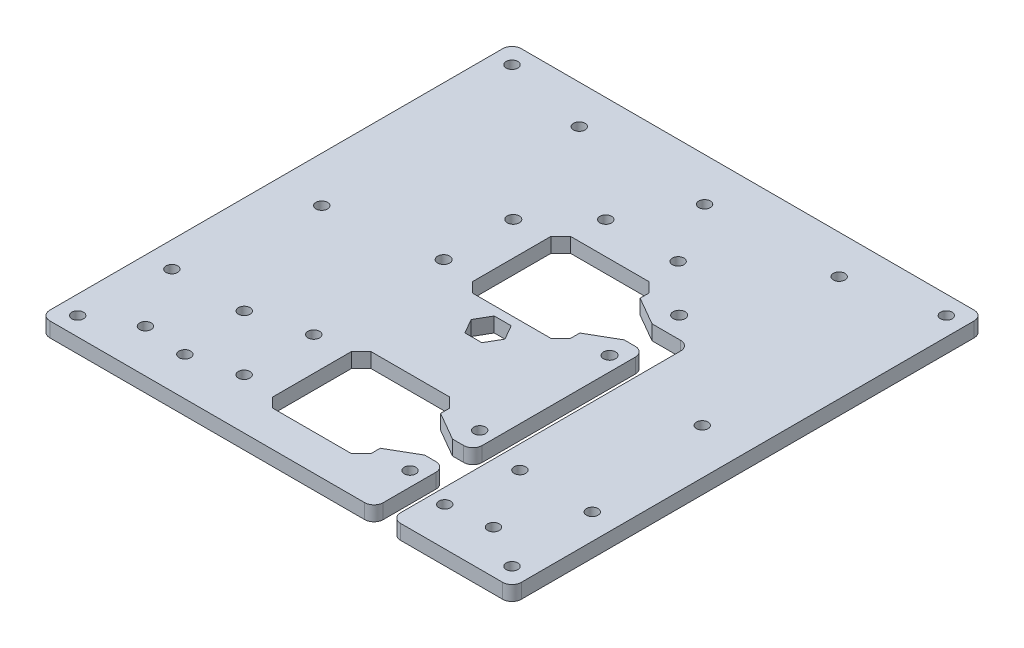
from build123d import *
from OCP.BRepFilletAPI import BRepFilletAPI_MakeChamfer

# Parameters (mm, degrees)
ESQUISSE1_W              = 203.2
ESQUISSE1_H              = 203.2
BOSS_EXTRU_1_DEPTH       = 6.35
ESQUISSE2_R              = 2.5
ENL_V_MAT_EXTRU_1_DEPTH  = 144.824345992
ESQUISSE3_R              = 2.5
ENL_V_MAT_EXTRU_2_DEPTH  = 144.824345992
ESQUISSE4_R              = 2.5
ENL_V_MAT_EXTRU_3_DEPTH  = 144.824345992
ESQUISSE6_R              = 2.5
ENL_V_MAT_EXTRU_5_DEPTH  = 144.824345992
ENL_V_MAT_EXTRU_9_DEPTH  = 144.824345992
ENL_V_MAT_EXTRU_4_DEPTH  = 144.824345992
ENL_V_MAT_EXTRU_7_DEPTH  = 144.824345992
ENL_V_MAT_EXTRU_8_DEPTH  = 144.824345992
CONG_2_R                 = 4
ESQUISSE12_R             = 2.6
ENL_V_MAT_EXTRU_10_DEPTH = 144.824345992
CHANFREIN2_SIZE          = 7
CHANFREIN2_SIZE2         = 12.124355653
CHANFREIN3_SIZE          = 7
CHANFREIN3_SIZE2         = 12.124355653


with BuildPart() as part:
    # Esquisse1 → Boss.-Extru.1 (new body)
    with BuildSketch(Plane(origin=(0, 0, 0), x_dir=(1, 0, 0), z_dir=(0, 1, 0))):
        Rectangle(ESQUISSE1_W, ESQUISSE1_H)
    extrude(amount=BOSS_EXTRU_1_DEPTH)

    # Esquisse2 → Enlèv. mat.-Extru.1 (cut, through all)
    with BuildSketch(Plane(origin=(0, 6.35, 0), x_dir=(1, 0, 0), z_dir=(0, 1, 0))):
        with Locations(Location((-35.6, -49.85, 0), (0, 0, 270))):
            Circle(ESQUISSE2_R)
        with Locations(Location((-35.6, -79.85, 0), (0, 0, 270))):
            Circle(ESQUISSE2_R)
        with Locations(Location((35.9, -79.85, 0), (0, 0, 270))):
            Circle(ESQUISSE2_R)
        with Locations(Location((35.9, -49.85, 0), (0, 0, 270))):
            Circle(ESQUISSE2_R)
    extrude(amount=-ENL_V_MAT_EXTRU_1_DEPTH, mode=Mode.SUBTRACT)

    # Esquisse3 → Enlèv. mat.-Extru.2 (cut, through all)
    with BuildSketch(Plane(origin=(0, 6.35, 0), x_dir=(1, 0, 0), z_dir=(0, 1, 0))):
        with Locations(Location((-93.6, 93.6, 0), (0, 0, 270))):
            Circle(ESQUISSE3_R)
        with Locations(Location((93.6, 93.6, 0), (0, 0, 270))):
            Circle(ESQUISSE3_R)
        with Locations(Location((93.6, -93.6, 0), (0, 0, 270))):
            Circle(ESQUISSE3_R)
        with Locations(Location((-93.6, -93.6, 0), (0, 0, 270))):
            Circle(ESQUISSE3_R)
    extrude(amount=-ENL_V_MAT_EXTRU_2_DEPTH, mode=Mode.SUBTRACT)

    # Esquisse4 → Enlèv. mat.-Extru.3 (cut, through all)
    with BuildSketch(Plane(origin=(0, 6.35, 0), x_dir=(1, 0, 0), z_dir=(0, 1, 0))):
        with Locations(Location((15.588457268, 56, 0), (0, 0, 270))):
            Circle(ESQUISSE4_R)
        with Locations(Location((-15.588457268, 56, 0), (0, 0, 270))):
            Circle(ESQUISSE4_R)
        with Locations(Location((0, 83, 0), (0, 0, 270))):
            Circle(ESQUISSE4_R)
        with Locations(Location((-75, -83, 0), (0, 0, 270))):
            Circle(ESQUISSE4_R)
        with Locations(Location((-90.588457268, -56, 0), (0, 0, 270))):
            Circle(ESQUISSE4_R)
        with Locations(Location((-59.411542732, -56, 0), (0, 0, 270))):
            Circle(ESQUISSE4_R)
        with Locations(Location((59.413008586, -55.999154304, 0), (0, 0, 270))):
            Circle(ESQUISSE4_R)
        with Locations(Location((90.589923123, -55.999154304, 0), (0, 0, 270))):
            Circle(ESQUISSE4_R)
        with Locations(Location((75.001465855, -82.999154304, 0), (0, 0, 270))):
            Circle(ESQUISSE4_R)
    extrude(amount=-ENL_V_MAT_EXTRU_3_DEPTH, mode=Mode.SUBTRACT)

    # Esquisse6 → Enlèv. mat.-Extru.5 (cut, through all)
    with BuildSketch(Plane.XZ):
        with Locations(Location((-56, 85, 0), (0, 0, 270))):
            Circle(ESQUISSE6_R)
        with Locations(Location((-56, -85, 0), (0, 0, 270))):
            Circle(ESQUISSE6_R)
        with Locations(Location((-82, 0, 0), (0, 0, 270))):
            Circle(ESQUISSE6_R)
    enl_v_mat_extru_5 = extrude(amount=-ENL_V_MAT_EXTRU_5_DEPTH, mode=Mode.SUBTRACT)

    # Symétrie1: Enlèv. mat.-Extru.5 across plane
    add(enl_v_mat_extru_5.mirror(Plane(origin=(0, 0, 0), x_dir=(0, 0, 1), z_dir=(1, 0, 0))), mode=Mode.SUBTRACT)

    # Esquisse11 → Enlèv. mat.-Extru.9 (cut, through all)
    with BuildSketch(Plane(origin=(0, 6.35, 0), x_dir=(1, 0, 0), z_dir=(0, 1, 0))):
        Polygon((-16.978069991, 42.150000003), (16.978069991, 42.150000003), (21.15, 37.978069994), (21.15, 4.021930012), (16.978069991, -0.149999997), (-16.978069991, -0.149999997), (-21.15, 4.021930012), (-21.15, 37.978069994), align=None)
    extrude(amount=-ENL_V_MAT_EXTRU_9_DEPTH, mode=Mode.SUBTRACT)

    # Esquisse5 → Enlèv. mat.-Extru.4 (cut, through all)
    with BuildSketch(Plane(origin=(0, 6.35, 0), x_dir=(1, 0, 0), z_dir=(0, 1, 0))):
        Polygon((3.651740453, -4), (-3.651740453, -4), (-7.303480905, -10.325), (-3.651740453, -16.65), (3.651740453, -16.65), (7.303480905, -10.325), align=None)
    extrude(amount=-ENL_V_MAT_EXTRU_4_DEPTH, mode=Mode.SUBTRACT)

    # Esquisse9 → Enlèv. mat.-Extru.7 (cut, through all)
    with BuildSketch(Plane(origin=(0, 6.35, 0), x_dir=(1, 0, 0), z_dir=(0, 1, 0))):
        Polygon((-16.978069991, -43.85), (16.978069991, -43.85), (21.15, -48.021930009), (21.15, -81.978069991), (16.978069991, -86.15), (-16.978069991, -86.15), (-21.15, -81.978069991), (-21.15, -48.021930009), align=None)
    extrude(amount=-ENL_V_MAT_EXTRU_7_DEPTH, mode=Mode.SUBTRACT)

    # Esquisse10 → Enlèv. mat.-Extru.8 (cut, through all)
    with BuildSketch(Plane(origin=(0, 6.35, 0), x_dir=(1, 0, 0), z_dir=(0, 1, 0))):
        Polygon((21.15, -58.928069991), (42.1, -58.928069991), (42.1, 15.071930012), (21.15, 15.071930012), (21.15, 27.071930012), (49.6, 27.071930012), (49.6, 15.071930012), (49.6, -58.928069991), (49.6, -70.928069991), (49.6, -101.6), (42.1, -101.6), (42.1, -70.928069991), (21.15, -70.928069991), align=None)
    extrude(amount=-ENL_V_MAT_EXTRU_8_DEPTH, mode=Mode.SUBTRACT)

    # Congé2
    cong_2_edges = [part.edges().sort_by_distance(p)[0] for p in [
        (42.1, 3.175, 58.928069991),
        (42.1, 3.175, -15.071930012),
        (49.6, 3.175, -27.071930012),
        (49.6, 3.175, 101.6),
        (42.1, 3.175, 101.6),
        (42.1, 3.175, 70.928069991),
        (101.6, 3.175, 101.6),
        (-101.6, 3.175, 101.6),
        (-101.6, 3.175, -101.6),
        (101.6, 3.175, -101.6),
    ]]
    fillet(cong_2_edges, radius=CONG_2_R)

    # Esquisse12 → Enlèv. mat.-Extru.10 (cut, through all)
    with BuildSketch(Plane(origin=(0, 6.35, 0), x_dir=(1, 0, 0), z_dir=(0, 1, 0))):
        with Locations(Location((-35.6, 36.15, 0), (0, 0, 270))):
            Circle(ESQUISSE12_R)
        with Locations(Location((-35.6, 6.15, 0), (0, 0, 270))):
            Circle(ESQUISSE12_R)
        with Locations(Location((35.9, 6.15, 0), (0, 0, 270))):
            Circle(ESQUISSE12_R)
        with Locations(Location((35.9, 36.15, 0), (0, 0, 270))):
            Circle(ESQUISSE12_R)
    extrude(amount=-ENL_V_MAT_EXTRU_10_DEPTH, mode=Mode.SUBTRACT)

    # Chanfrein2: one chamfer whose edges measure the first distance from different faces: ONE call of the kernel's chamfer builder (chamfer() names one face for all edges)
    chanfrein2_edges_1 = [part.edges().sort_by_distance(p)[0] for p in [
        (21.15, 3.175, 70.928069991),
    ]]
    chanfrein2_side_1 = [part.faces().sort_by_distance(p)[0] for p in [
        (21.15, 3.175, 76.453069991),
    ]]
    chanfrein2_edges_2 = [part.edges().sort_by_distance(p)[0] for p in [
        (21.15, 3.175, 58.928069991),
    ]]
    chanfrein2_side_2 = [part.faces().sort_by_distance(p)[0] for p in [
        (21.15, 3.175, 53.475),
    ]]
    chanfrein2 = BRepFilletAPI_MakeChamfer(part.part.solid().wrapped)
    for e in chanfrein2_edges_1:
        chanfrein2.Add(CHANFREIN2_SIZE, CHANFREIN2_SIZE2, e.wrapped, chanfrein2_side_1[0].wrapped)  # the first distance lies on this face
    for e in chanfrein2_edges_2:
        chanfrein2.Add(CHANFREIN2_SIZE, CHANFREIN2_SIZE2, e.wrapped, chanfrein2_side_2[0].wrapped)  # the first distance lies on this face
    add(Compound.cast(chanfrein2.Shape()), mode=Mode.REPLACE)

    # Chanfrein3: one chamfer whose edges measure the first distance from different faces: ONE call of the kernel's chamfer builder (chamfer() names one face for all edges)
    chanfrein3_edges_1 = [part.edges().sort_by_distance(p)[0] for p in [
        (21.15, 3.175, -15.071930012),
    ]]
    chanfrein3_side_1 = [part.faces().sort_by_distance(p)[0] for p in [
        (21.15, 3.175, -9.546930012),
    ]]
    chanfrein3_edges_2 = [part.edges().sort_by_distance(p)[0] for p in [
        (21.15, 3.175, -27.071930012),
    ]]
    chanfrein3_side_2 = [part.faces().sort_by_distance(p)[0] for p in [
        (21.15, 3.175, -32.525000003),
    ]]
    chanfrein3 = BRepFilletAPI_MakeChamfer(part.part.solid().wrapped)
    for e in chanfrein3_edges_1:
        chanfrein3.Add(CHANFREIN3_SIZE, CHANFREIN3_SIZE2, e.wrapped, chanfrein3_side_1[0].wrapped)  # the first distance lies on this face
    for e in chanfrein3_edges_2:
        chanfrein3.Add(CHANFREIN3_SIZE, CHANFREIN3_SIZE2, e.wrapped, chanfrein3_side_2[0].wrapped)  # the first distance lies on this face
    add(Compound.cast(chanfrein3.Shape()), mode=Mode.REPLACE)


solid = part.part
